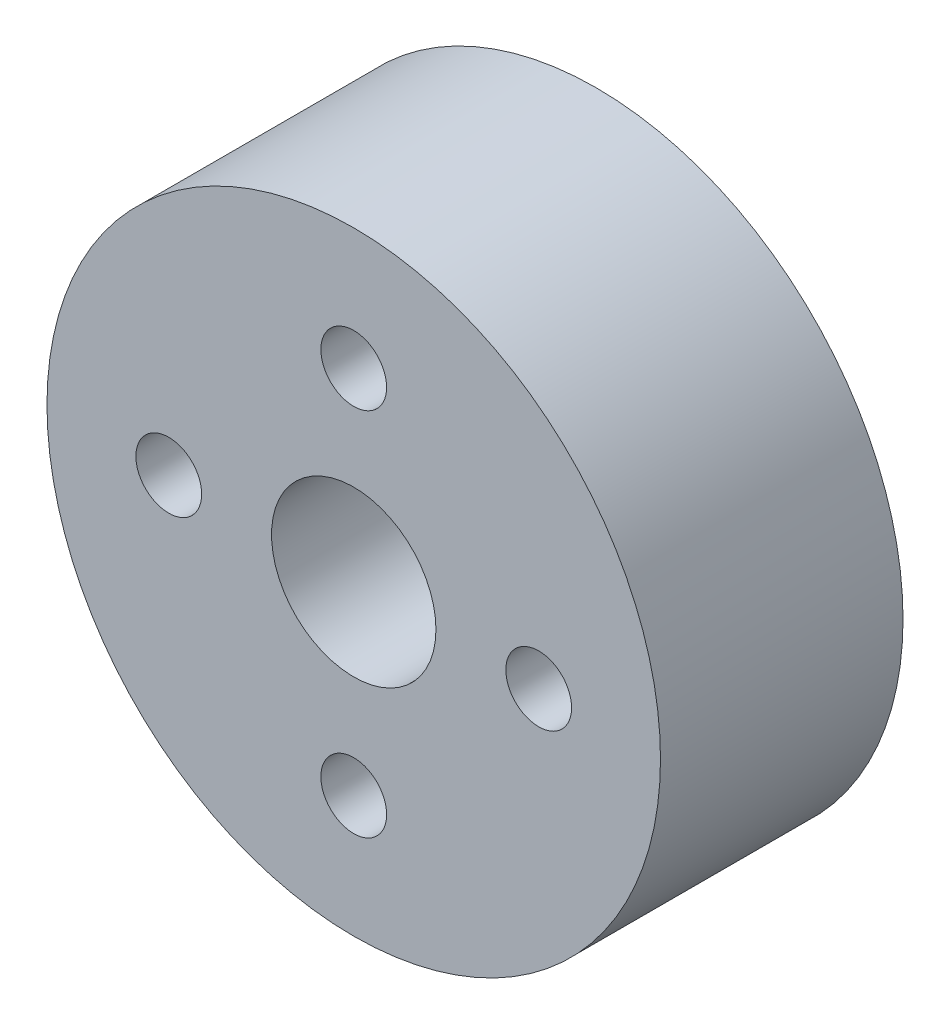
from build123d import *

# Parameters (mm, degrees)
SKETCH_1_R                  = 14.925
SKETCH_1_R_2                = 4
SKETCH_1_R_3                = 1.6
F_05_PAN_HORN_JOURNAL_DEPTH = 11.8


with BuildPart() as part:
    # Эскиз1 → 05_Pan_horn_journal (new body)
    with BuildSketch(Plane.XY):
        Circle(SKETCH_1_R)
        Circle(SKETCH_1_R_2, mode=Mode.SUBTRACT)
        with Locations((-9, 0)):
            Circle(SKETCH_1_R_3, mode=Mode.SUBTRACT)
        with Locations((9, 0)):
            Circle(SKETCH_1_R_3, mode=Mode.SUBTRACT)
        with Locations((0, 9)):
            Circle(SKETCH_1_R_3, mode=Mode.SUBTRACT)
        with Locations((0, -9)):
            Circle(SKETCH_1_R_3, mode=Mode.SUBTRACT)
    extrude(amount=F_05_PAN_HORN_JOURNAL_DEPTH)


solid = part.part
